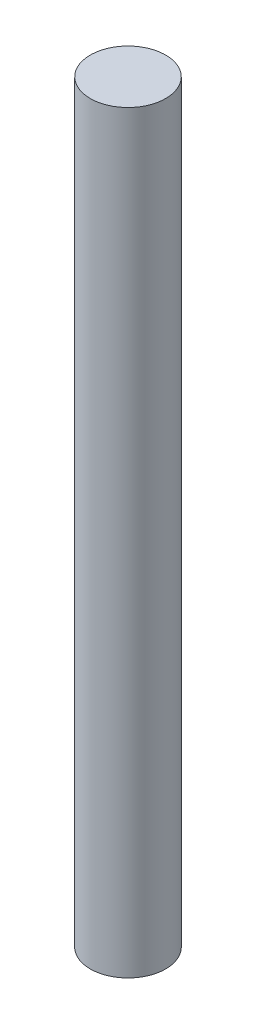
from build123d import *

# Parameters (mm, degrees)
SKETCH1_R           = 1
BOSS_EXTRUDE1_DEPTH = 20


with BuildPart() as part:
    # Sketch1 → Boss-Extrude1 (new body)
    with BuildSketch(Plane(origin=(0, 0, 0), x_dir=(1, 0, 0), z_dir=(0, 1, 0))):
        with Locations(Location((0, 0, 0), (0, 0, 270))):
            Circle(SKETCH1_R)
    extrude(amount=BOSS_EXTRUDE1_DEPTH)


solid = part.part
